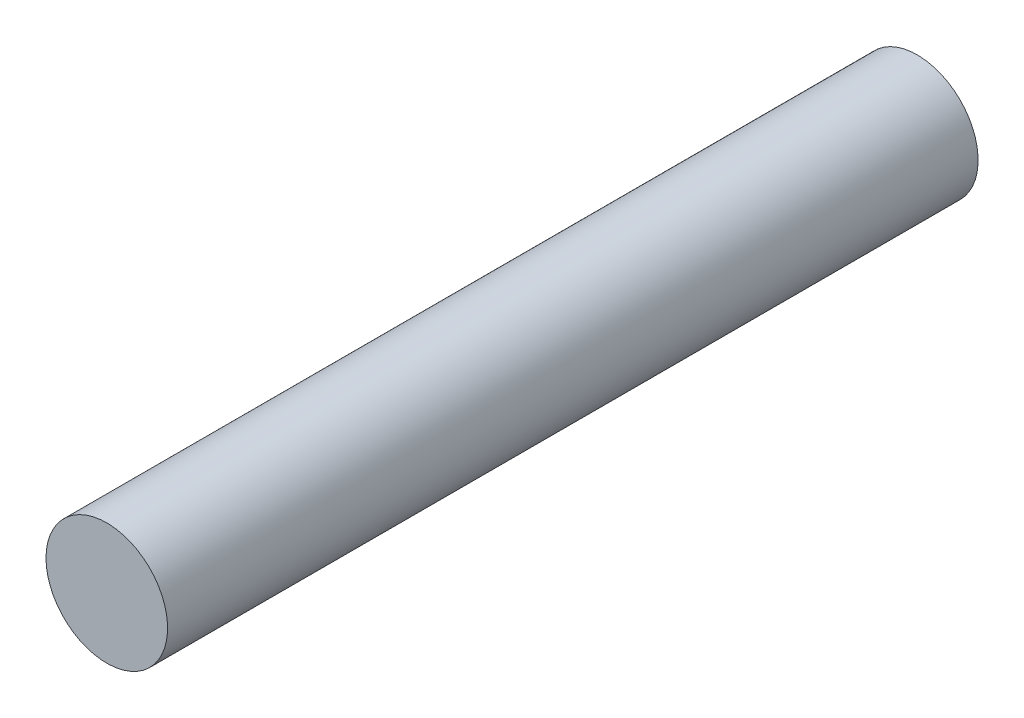
from build123d import *

# Parameters (mm, degrees)
ESQUISSE1_R        = 4.5
BOSS_EXTRU_1_DEPTH = 60


with BuildPart() as part:
    # Esquisse1 → Boss.-Extru.1 (new body)
    with BuildSketch(Plane.XY):
        with Locations(Location((0, 0, 0), (0, 0, 180))):
            Circle(ESQUISSE1_R)
    extrude(amount=BOSS_EXTRU_1_DEPTH)


solid = part.part
